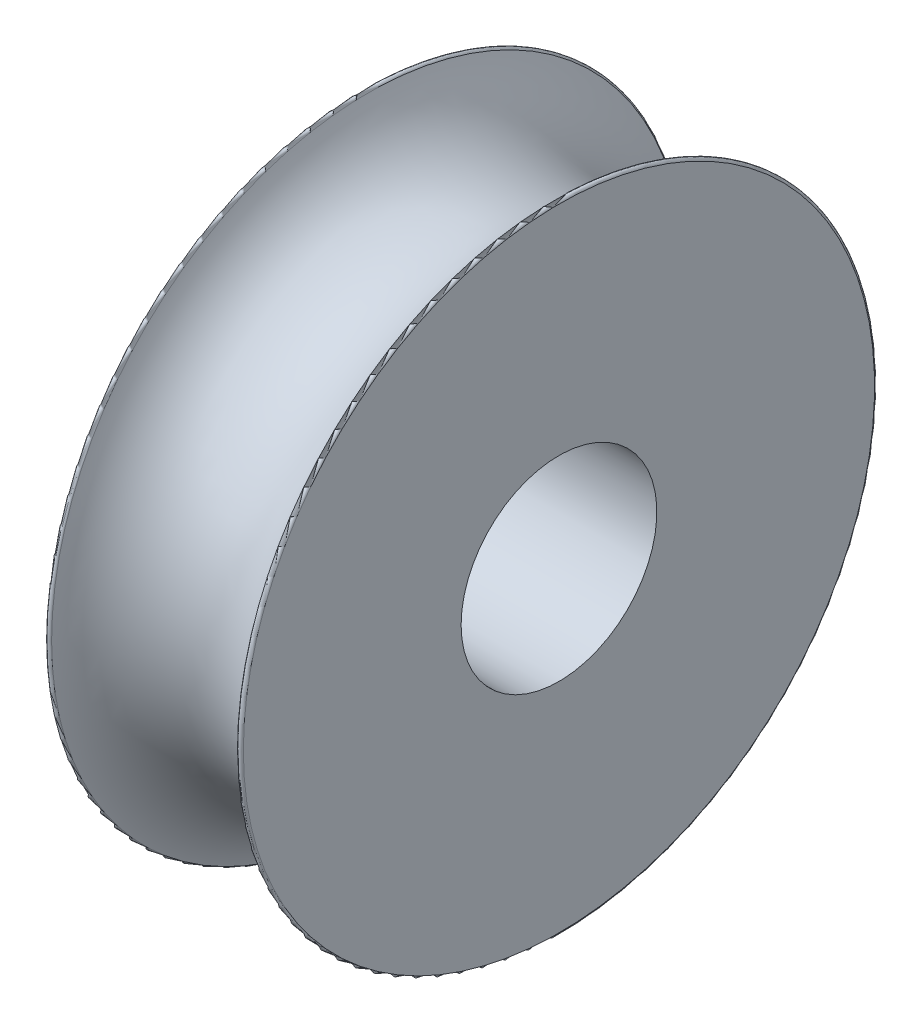
from build123d import *


with BuildPart() as part:
    # Sketch1 → Revolve1 (revolve)
    with BuildSketch(Plane.XY, mode=Mode.PRIVATE) as revolve1_sk:
        with BuildLine():
            Line((0, 0), (4, 0))
            Line((4, 0), (4, 4.450390625))
            ThreePointArc((4, 4.450390625), (3.958108719, 4.499395942), (3.903182771, 4.465638858))
            ThreePointArc((3.903182771, 4.465638858), (2, 3.080370783), (0.096817229, 4.465638858))
            ThreePointArc((0.096817229, 4.465638858), (0.041891281, 4.499395942), (0, 4.450390625))
            Line((0, 4.450390625), (0, 0))
        make_face()
    revolve(revolve1_sk.sketch.rotate(Axis((0, -2, 0), (1, 0, 0)), 90), axis=Axis((0, -2, 0), (1, 0, 0)))


solid = part.part
